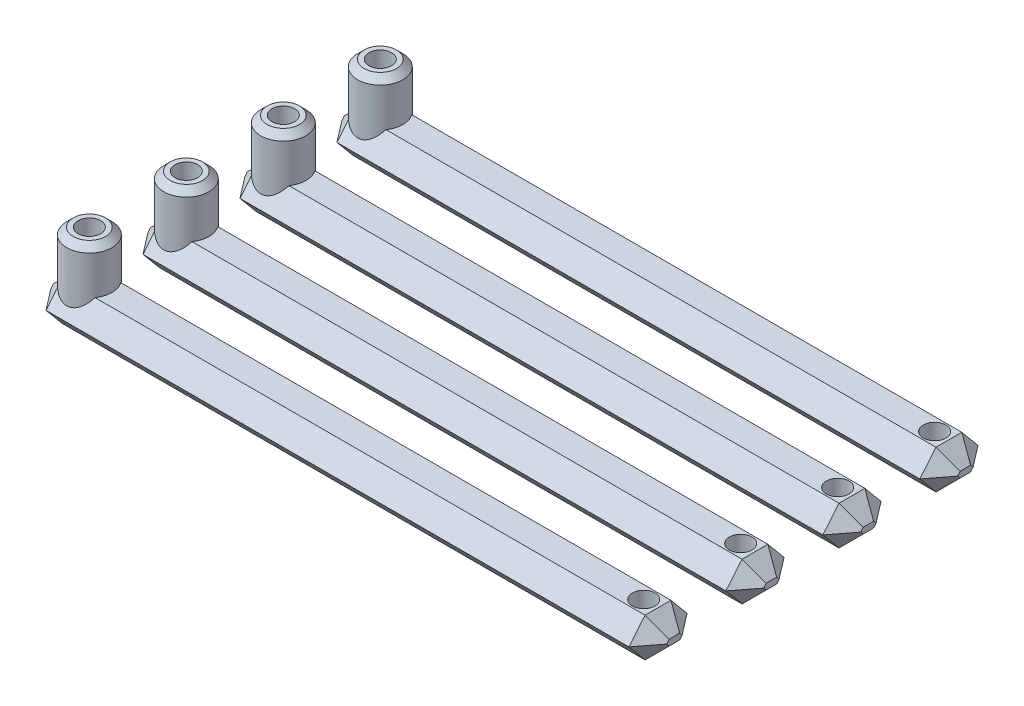
from build123d import *

# Parameters (mm, degrees)
BOSS_EXTRUDE1_DEPTH             = 47.625
SKETCH2_R                       = 1.75
CUT_EXTRUDE1_DEPTH              = 6
CHAMFER1_SIZE                   = 2.54
CHAMFER2_SIZE                   = 2.54
SKETCH3_R                       = 3.5
SKETCH3_R_2                     = 1.75
BOSS_EXTRUDE2_DEPTH             = 7
BOSS_EXTRUDE2_DIRECTION_2_REACH = 50.212
CHAMFER3_SIZE                   = 1
LPATTERN1_COUNT                 = 4
LPATTERN1_PITCH                 = 15


with BuildPart() as part:
    # Sketch1 → Boss-Extrude1 (new, symmetric)
    with BuildSketch(Plane(origin=(0, 0, 0), x_dir=(0, 0, -1), z_dir=(1, 0, 0))):
        Polygon((-2, -3), (-4.5, 0), (-2, 3), (2, 3), (4.5, 0), (2, -3), align=None)
    extrude(amount=BOSS_EXTRUDE1_DEPTH, both=True)

    # Sketch2 → Cut-Extrude1 (cut)
    with BuildSketch(Plane.XZ.offset(3)):
        with Locations(Location((42.875, 0, 0), (0, 0, 270))):
            Circle(SKETCH2_R)
    cut_extrude1 = extrude(amount=-CUT_EXTRUDE1_DEPTH, mode=Mode.SUBTRACT)

    # Chamfer1
    chamfer1_edges = [part.edges().sort_by_distance(p)[0] for p in [
        (47.625, -1.5, -3.25),
        (47.625, -3, 0),
        (47.625, -1.5, 3.25),
        (47.625, 1.5, 3.25),
        (47.625, 3, 0),
        (47.625, 1.5, -3.25),
    ]]
    chamfer(chamfer1_edges, length=CHAMFER1_SIZE)

    # Mirror4: Cut-Extrude1 across plane
    add(cut_extrude1.mirror(Plane(origin=(0, 0, 0), x_dir=(0, 0, 1), z_dir=(1, 0, 0))), mode=Mode.SUBTRACT)

    # Chamfer2
    chamfer2_edges = [part.edges().sort_by_distance(p)[0] for p in [
        (-47.625, 1.5, 3.25),
        (-47.625, -1.5, 3.25),
        (-47.625, -3, 0),
        (-47.625, -1.5, -3.25),
        (-47.625, 1.5, -3.25),
        (-47.625, 3, 0),
    ]]
    chamfer(chamfer2_edges, length=CHAMFER2_SIZE)

    # Sketch3 → Boss-Extrude2 (add)
    with BuildSketch(Plane(origin=(0, 3, 0), x_dir=(1, 0, 0), z_dir=(0, 1, 0))):
        with Locations(Location((-42.875, 0, 0), (0, 0, 270))):
            Circle(SKETCH3_R)
        with Locations(Location((-42.875, 0, 0), (0, 0, 90))):
            Circle(SKETCH3_R_2, mode=Mode.SUBTRACT)
    extrude(amount=BOSS_EXTRUDE2_DEPTH)

    # Sketch3 → Boss-Extrude2 direction 2 (add, up to next)
    with BuildSketch(Plane(origin=(0, 3, 0), x_dir=(1, 0, 0), z_dir=(0, 1, 0)), mode=Mode.PRIVATE) as boss_extrude2_direction_2_sk1:
        with Locations(Location((-42.875, 0, 0), (0, 0, 270))):
            Circle(SKETCH3_R)
        with Locations(Location((-42.875, 0, 0), (0, 0, 90))):
            Circle(SKETCH3_R_2, mode=Mode.SUBTRACT)
    boss_extrude2_direction_2_tool1 = extrude(boss_extrude2_direction_2_sk1.sketch, amount=-BOSS_EXTRUDE2_DIRECTION_2_REACH, mode=Mode.PRIVATE) - part.part
    add(boss_extrude2_direction_2_tool1.solids().sort_by_distance((-42.875, 3, -3.401005))[0])

    # Chamfer3
    chamfer3_edges = [part.edges().sort_by_distance(p)[0] for p in [
        (-42.875, 10, -3.5),
    ]]
    chamfer(chamfer3_edges, length=CHAMFER3_SIZE)


with BuildPart() as lpattern1_1:
    # LPattern1: pattern copy
    add(part.part.moved(Location(Vector(0, 0, 1) * (1 * LPATTERN1_PITCH))))


with BuildPart() as lpattern1_2:
    # LPattern1: pattern copy
    add(part.part.moved(Location(Vector(0, 0, 1) * (2 * LPATTERN1_PITCH))))


with BuildPart() as lpattern1_3:
    # LPattern1: pattern copy
    add(part.part.moved(Location(Vector(0, 0, 1) * (3 * LPATTERN1_PITCH))))


solid = Compound([part.part, lpattern1_1.part, lpattern1_2.part, lpattern1_3.part])
